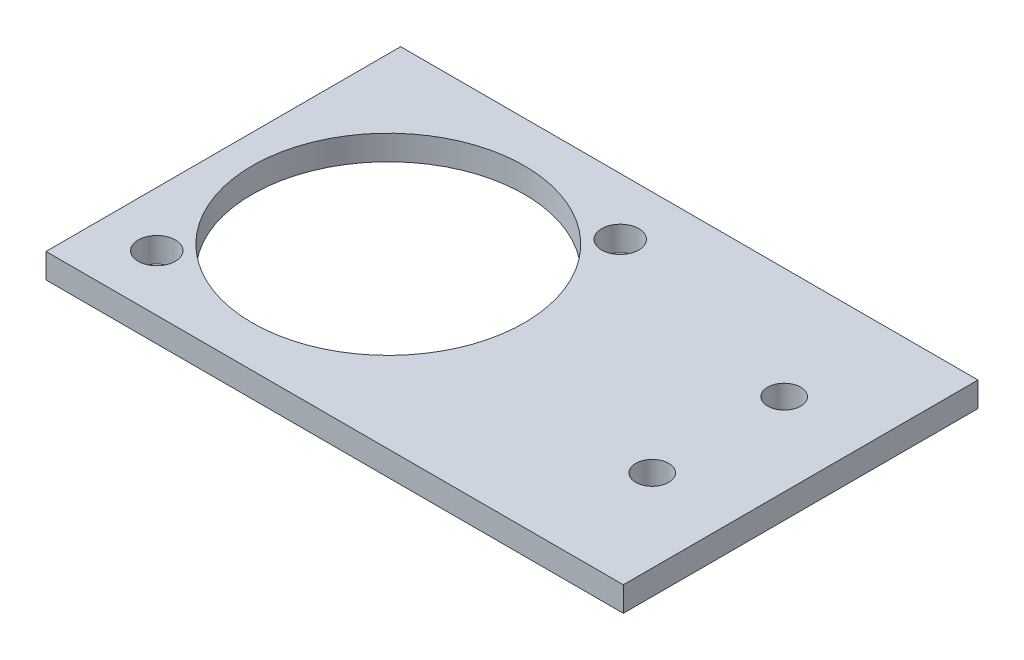
from build123d import *

# Parameters (mm, degrees)
SKETCH1_W           = 70
SKETCH1_H           = 43
SKETCH1_R           = 16.5
SKETCH1_R_2         = 2.25
SKETCH1_R_3         = 2
BOSS_EXTRUDE1_DEPTH = 3


with BuildPart() as part:
    # Sketch1 → Boss-Extrude1 (new body)
    with BuildSketch(Plane(origin=(0, 0, 0), x_dir=(1, 0, 0), z_dir=(0, 1, 0))):
        Rectangle(SKETCH1_W, SKETCH1_H)
        with Locations(Location((-15, 0, 0), (0, 0, 270))):
            Circle(SKETCH1_R, mode=Mode.SUBTRACT)
        with Locations(Location((-1.46, 14.58, 0), (0, 0, 270))):
            Circle(SKETCH1_R_2, mode=Mode.SUBTRACT)
        with Locations(Location((-28.37, -14.7, 0), (0, 0, 270))):
            Circle(SKETCH1_R_2, mode=Mode.SUBTRACT)
        with Locations(Location((25, 8, 0), (0, 0, 270))):
            Circle(SKETCH1_R_3, mode=Mode.SUBTRACT)
        with Locations(Location((25, -8, 0), (0, 0, 270))):
            Circle(SKETCH1_R_3, mode=Mode.SUBTRACT)
    extrude(amount=BOSS_EXTRUDE1_DEPTH)


solid = part.part
